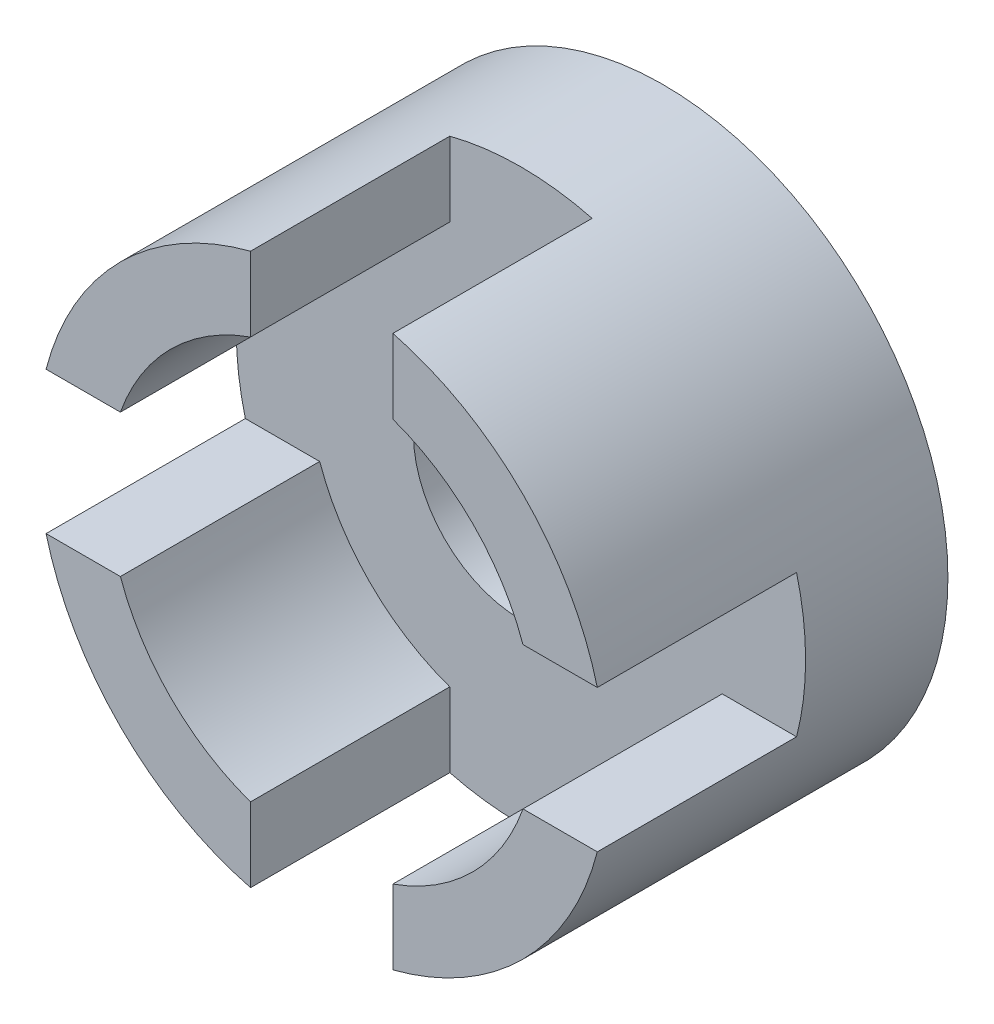
from build123d import *

# Parameters (mm, degrees)
SKETCH2_R            = 6.35
SKETCH2_R_2          = 4.7625
SKETCH2_R_3          = 3.5000057
BOSS_EXTRUDE1_DEPTH  = 7.62
SKETCH3_R            = 4.7625
SKETCH3_R_2          = 3.5000057
CUT_EXTRUDE1_DEPTH   = 4.445
M4_CLEARANCE_HOLE1_D = 4.8
CUT_EXTRUDE2_DEPTH   = 4.445
CIRPATTERN1_COUNT    = 4


with BuildPart() as part:
    # Sketch2 → Boss-Extrude1 (new body)
    # profile 1 of 3: a face of its own
    with BuildSketch(Plane.XY):
        with Locations(Location((0, 0, 0), (0, 0, 180))):
            Circle(SKETCH2_R)
        Circle(SKETCH2_R_2, mode=Mode.SUBTRACT)
    # profile 2 of 3: a face of its own
    with BuildSketch(Plane.XY):
        Circle(SKETCH2_R_2)
        Circle(SKETCH2_R_3, mode=Mode.SUBTRACT)
    # profile 3 of 3: a face of its own
    with BuildSketch(Plane.XY):
        Circle(SKETCH2_R_3)
    extrude(amount=BOSS_EXTRUDE1_DEPTH)

    # Sketch3 → Cut-Extrude1 (cut)
    # profile 1 of 2: a face of its own
    with BuildSketch(Plane.XY.offset(7.62)):
        Circle(SKETCH3_R)
        Circle(SKETCH3_R_2, mode=Mode.SUBTRACT)
    # profile 2 of 2: a face of its own
    with BuildSketch(Plane.XY.offset(7.62)):
        Circle(SKETCH3_R_2)
    extrude(amount=-CUT_EXTRUDE1_DEPTH, mode=Mode.SUBTRACT)

    # M4 Clearance Hole1 (through all)
    with Locations(Plane.XY.offset(3.175)):
        with Locations((0, 0)):
            Hole(M4_CLEARANCE_HOLE1_D / 2)

    # Sketch6 → Cut-Extrude2 (cut)
    with BuildSketch(Plane.XY.offset(7.62)):
        with BuildLine():
            ThreePointArc((1.5875, 6.148361062), (0, 6.35), (-1.5875, 6.148361062))
            Line((-1.5875, 6.148361062), (-1.5875, 4.490128061))
            ThreePointArc((-1.5875, 4.490128061), (0, 4.7625), (1.5875, 4.490128061))
            Line((1.5875, 4.490128061), (1.5875, 6.148361062))
        make_face()
    cut_extrude2 = extrude(amount=-CUT_EXTRUDE2_DEPTH, mode=Mode.SUBTRACT)

    # CirPattern1: Cut-Extrude2 ×4 about axis
    cirpattern1_axis = Axis((0, 0, 0), (0, 0, 1))
    for i in range(1, CIRPATTERN1_COUNT):
        add(cut_extrude2.rotate(cirpattern1_axis, i * 360 / CIRPATTERN1_COUNT), mode=Mode.SUBTRACT)


solid = part.part
